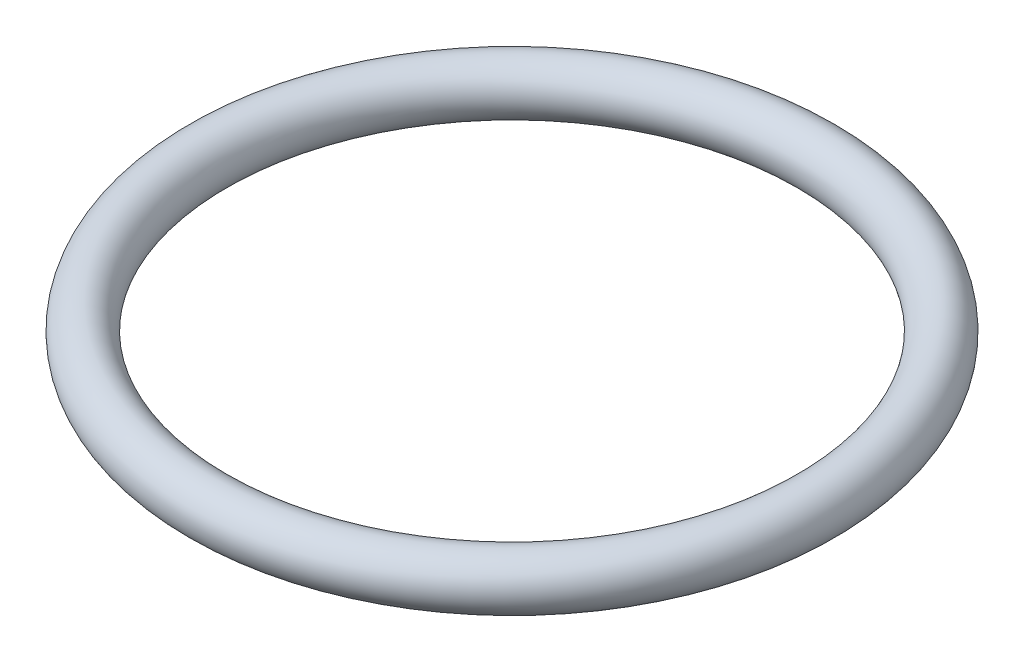
from build123d import *

# Parameters (mm, degrees)
SZKIC1_R = 1.5


with BuildPart() as part:
    # Szkic1 → Obrót1 (revolve)
    with BuildSketch(Plane.XY, mode=Mode.PRIVATE) as obr_t1_sk:
        with Locations((-17.5, -1.38996772)):
            Circle(SZKIC1_R)
    revolve(obr_t1_sk.sketch.rotate(Axis((0, 5.124503541, 0), (0, -1, 0)), 270), axis=Axis((0, 5.124503541, 0), (0, -1, 0)))


solid = part.part
